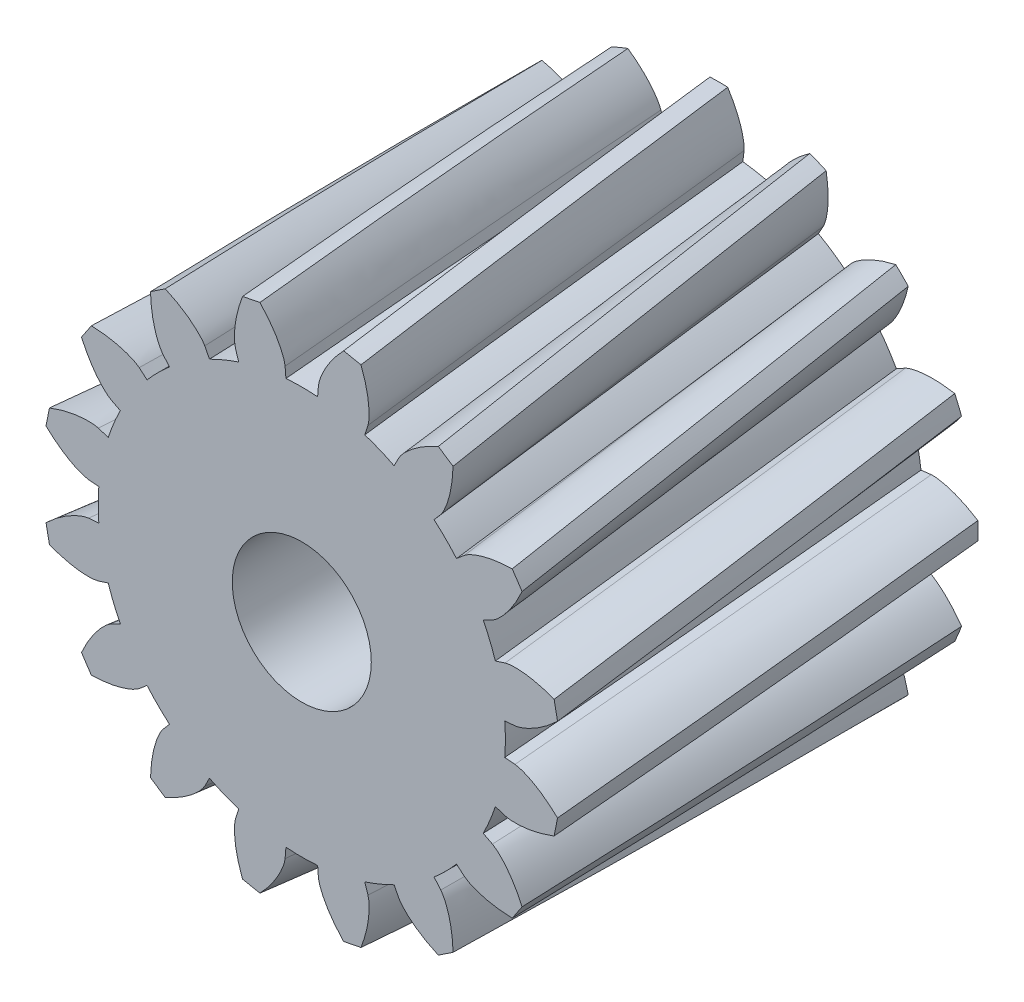
from build123d import *

# Parameters (mm, degrees)
SKETCH5_R                    = 4.392958179
SKETCH5_R_2                  = 1.5
EXTRUDE_BODY_DEPTH           = 9
SWEEP_HALF_TOOTH_PITCH       = 288
SWEEP_HALF_TOOTH_HEIGHT      = 9
SWEEP_HALF_TOOTH_RADIUS      = 4.392958179
SWEEP_HALF_TOOTH_START_ANGLE = 90
PATTERN_HALF_TEETH_COUNT     = 16


with BuildPart() as part:
    # Sketch5 → Extrude Body (new body)
    with BuildSketch(Plane.XY):
        Circle(SKETCH5_R)
        Circle(SKETCH5_R_2, mode=Mode.SUBTRACT)
    extrude(amount=EXTRUDE_BODY_DEPTH)

    # Sweep Half Tooth: sweep along a helix
    with BuildLine() as sweep_half_tooth_path:
        add(Helix(SWEEP_HALF_TOOTH_PITCH, SWEEP_HALF_TOOTH_HEIGHT, SWEEP_HALF_TOOTH_RADIUS, center=(0, 0, 0), direction=(0, 0, 1), lefthand=True, mode=Mode.PRIVATE).rotate(Axis((0, 0, 0), (0, 0, 1)), SWEEP_HALF_TOOTH_START_ANGLE))
    # Sketch6 → Sweep Half Tooth (sweep)
    with BuildSketch(Plane.XY):
        with BuildLine():
            Line((0.544967932, 4.583503643), (0.177099113, 1.489508612))
            ThreePointArc((0.177099113, 1.489508612), (0, 1.5), (-0.177099113, 1.489508612))
            Line((-0.177099113, 1.489508612), (-0.544967932, 4.583503643))
            add(Edge.make_bspline(
                [(-0.544967932, 4.583503643), (-0.549780193, 4.673578276), (-0.494162279, 5.032371309), (-0.334457197, 5.361804675), (-0.191039587, 5.589694542)],
                knots=[0, 0, 0, 0, 0.250023243, 1, 1, 1, 1], degree=3))
            ThreePointArc((-0.191039587, 5.589694542), (0, 5.592958179), (0.191039587, 5.589694542))
            add(Edge.make_bspline(
                [(0.544967932, 4.583503643), (0.549780193, 4.673578276), (0.494162279, 5.032371309), (0.334457197, 5.361804675), (0.191039587, 5.589694542)],
                knots=[0, 0, 0, 0, 0.250023243, 1, 1, 1, 1], degree=3))
        make_face()
    sweep_half_tooth = sweep(path=sweep_half_tooth_path.line, is_frenet=True)

    # Pattern Half Teeth: Sweep Half Tooth ×16 about axis
    pattern_half_teeth_axis = Axis((0, 0, 9), (0, 0, -1))
    for i in range(1, PATTERN_HALF_TEETH_COUNT):
        add(sweep_half_tooth.rotate(pattern_half_teeth_axis, i * 360 / PATTERN_HALF_TEETH_COUNT))


solid = part.part
